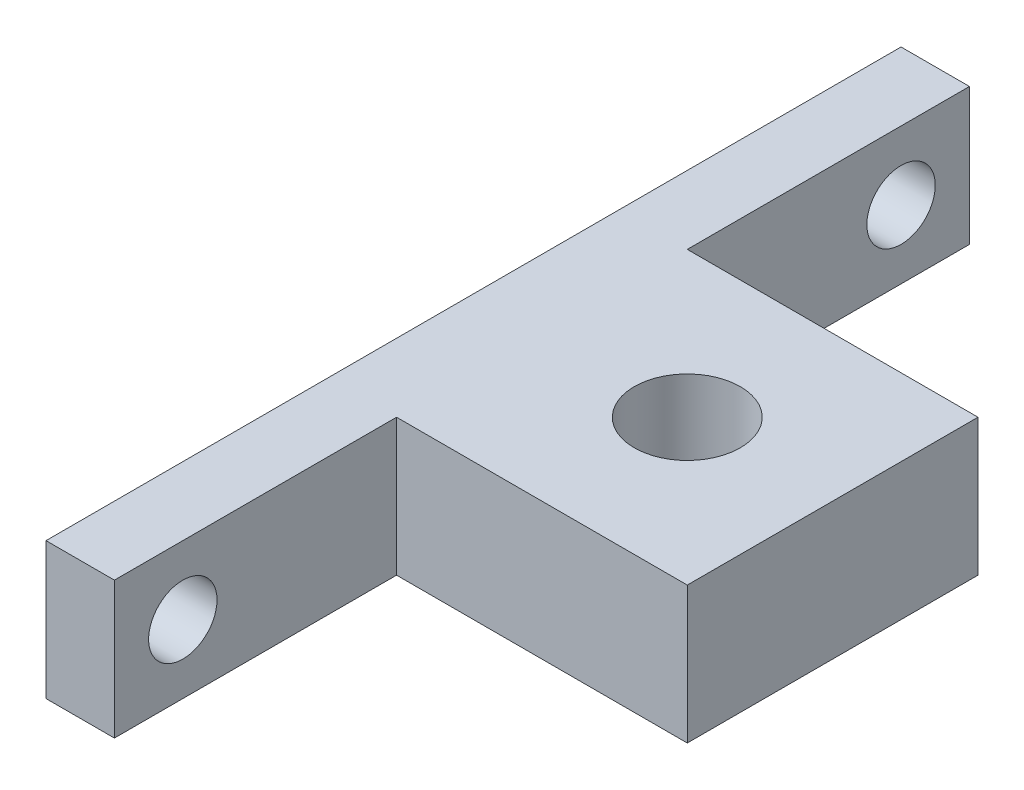
from build123d import *

# Parameters (mm, degrees)
SKETCH_1_W          = 50
SKETCH_1_H          = 8
SKETCH_1_R          = 2
EXTRUDE_1_DEPTH     = 4
SKETCH_2_W          = 17
SKETCH_2_H          = 8
EXTRUDE_2_DEPTH     = 17
SKETCH_3_R          = 3.1
CUT_EXTRUDE_1_DEPTH = 34.615472628


with BuildPart() as part:
    # 草图1 → 凸台-拉伸1 (new body)
    with BuildSketch(Plane(origin=(0, 0, 0), x_dir=(0, 0, -1), z_dir=(1, 0, 0))):
        Rectangle(SKETCH_1_W, SKETCH_1_H)
        with Locations((-21, 0)):
            Circle(SKETCH_1_R, mode=Mode.SUBTRACT)
        with Locations(Location((21, 0, 0), (0, 0, 180))):
            Circle(SKETCH_1_R, mode=Mode.SUBTRACT)
    extrude(amount=EXTRUDE_1_DEPTH)

    # 草图2 → 凸台-拉伸2 (add)
    with BuildSketch(Plane(origin=(4, 0, 0), x_dir=(0, 0, -1), z_dir=(1, 0, 0))):
        Rectangle(SKETCH_2_W, SKETCH_2_H)
    extrude(amount=EXTRUDE_2_DEPTH)

    # 草图3 → 切除-拉伸1 (cut, through all)
    with BuildSketch(Plane.XZ.offset(4)):
        with Locations(Location((12.5, 0, 0), (0, 0, 270))):
            Circle(SKETCH_3_R)
    extrude(amount=-CUT_EXTRUDE_1_DEPTH, mode=Mode.SUBTRACT)


solid = part.part
